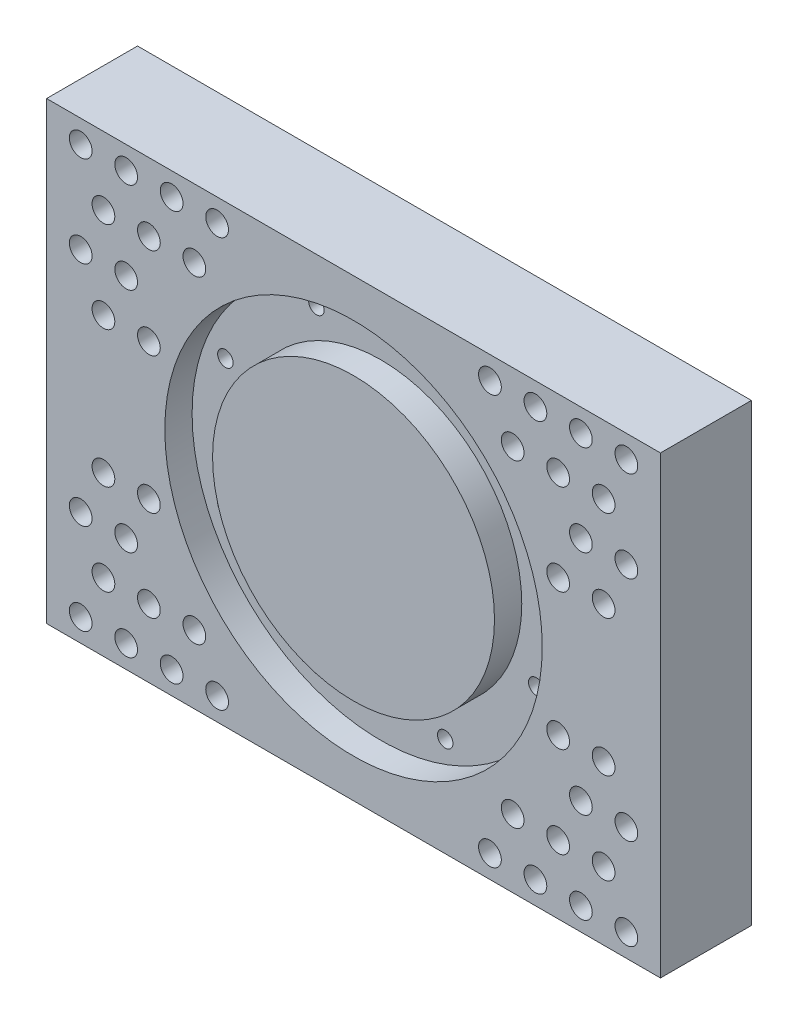
from build123d import *

# Parameters (mm, degrees)
SKETCH_1_W          = 135
SKETCH_1_H          = 100
EXTRUDE_1_DEPTH     = 20
SKETCH_2_R          = 1.7
CUT_EXTRUDE_1_DEPTH = 20
SKETCH_3_R          = 41.5
SKETCH_3_R_2        = 31
CUT_EXTRUDE_2_DEPTH = 6
SKETCH_4_R          = 2.5
CUT_EXTRUDE_3_DEPTH = 20


with BuildPart() as part:
    # 草图1 → 凸台-拉伸1 (new body)
    with BuildSketch(Plane.XY):
        Rectangle(SKETCH_1_W, SKETCH_1_H)
    extrude(amount=EXTRUDE_1_DEPTH)

    # 草图2 → 切除-拉伸1 (cut)
    with BuildSketch(Plane.XY.offset(20)):
        with Locations((14.159286998, 34.183542703)):
            Circle(SKETCH_2_R)
        with Locations((34.183542703, 14.159286998)):
            Circle(SKETCH_2_R)
        with Locations((34.183542703, -14.159286998)):
            Circle(SKETCH_2_R)
        with Locations((14.159286998, -34.183542703)):
            Circle(SKETCH_2_R)
        with Locations((-14.159286998, -34.183542703)):
            Circle(SKETCH_2_R)
        with Locations((-34.183542703, -14.159286998)):
            Circle(SKETCH_2_R)
        with Locations((-34.183542703, 14.159286998)):
            Circle(SKETCH_2_R)
        with Locations((-14.159286998, 34.183542703)):
            Circle(SKETCH_2_R)
    extrude(amount=-CUT_EXTRUDE_1_DEPTH, mode=Mode.SUBTRACT)

    # 草图3 → 切除-拉伸2 (cut)
    with BuildSketch(Plane.XY.offset(20)):
        Circle(SKETCH_3_R)
        Circle(SKETCH_3_R_2, mode=Mode.SUBTRACT)
    extrude(amount=-CUT_EXTRUDE_2_DEPTH, mode=Mode.SUBTRACT)

    # 草图4 → 切除-拉伸3 (cut)
    with BuildSketch(Plane.XY.offset(20)):
        with Locations((-60, 45)):
            Circle(SKETCH_4_R)
        with Locations((-50, 45)):
            Circle(SKETCH_4_R)
        with Locations((-55, 35)):
            Circle(SKETCH_4_R)
        with Locations((-40, 45)):
            Circle(SKETCH_4_R)
        with Locations((-45, 35)):
            Circle(SKETCH_4_R)
        with Locations((-30, 45)):
            Circle(SKETCH_4_R)
        with Locations((-35, 35)):
            Circle(SKETCH_4_R)
        with Locations((-50, 25)):
            Circle(SKETCH_4_R)
        with Locations((-55, 15)):
            Circle(SKETCH_4_R)
        with Locations((-60, 25)):
            Circle(SKETCH_4_R)
        with Locations((-45, 15)):
            Circle(SKETCH_4_R)
        with Locations(Location((45, 15, 0), (0, 0, 180))):
            Circle(SKETCH_4_R)
        with Locations(Location((60, 25, 0), (0, 0, 180))):
            Circle(SKETCH_4_R)
        with Locations(Location((55, 15, 0), (0, 0, 180))):
            Circle(SKETCH_4_R)
        with Locations(Location((50, 25, 0), (0, 0, 180))):
            Circle(SKETCH_4_R)
        with Locations(Location((35, 35, 0), (0, 0, 180))):
            Circle(SKETCH_4_R)
        with Locations(Location((30, 45, 0), (0, 0, 180))):
            Circle(SKETCH_4_R)
        with Locations(Location((45, 35, 0), (0, 0, 180))):
            Circle(SKETCH_4_R)
        with Locations(Location((40, 45, 0), (0, 0, 180))):
            Circle(SKETCH_4_R)
        with Locations(Location((55, 35, 0), (0, 0, 180))):
            Circle(SKETCH_4_R)
        with Locations(Location((50, 45, 0), (0, 0, 180))):
            Circle(SKETCH_4_R)
        with Locations(Location((60, 45, 0), (0, 0, 180))):
            Circle(SKETCH_4_R)
        with Locations((60, -45)):
            Circle(SKETCH_4_R)
        with Locations((50, -45)):
            Circle(SKETCH_4_R)
        with Locations((55, -35)):
            Circle(SKETCH_4_R)
        with Locations((40, -45)):
            Circle(SKETCH_4_R)
        with Locations((45, -35)):
            Circle(SKETCH_4_R)
        with Locations((30, -45)):
            Circle(SKETCH_4_R)
        with Locations((35, -35)):
            Circle(SKETCH_4_R)
        with Locations((50, -25)):
            Circle(SKETCH_4_R)
        with Locations((55, -15)):
            Circle(SKETCH_4_R)
        with Locations((60, -25)):
            Circle(SKETCH_4_R)
        with Locations((45, -15)):
            Circle(SKETCH_4_R)
        with Locations(Location((-45, -15, 0), (0, 0, 180))):
            Circle(SKETCH_4_R)
        with Locations(Location((-60, -25, 0), (0, 0, 180))):
            Circle(SKETCH_4_R)
        with Locations(Location((-55, -15, 0), (0, 0, 180))):
            Circle(SKETCH_4_R)
        with Locations(Location((-50, -25, 0), (0, 0, 180))):
            Circle(SKETCH_4_R)
        with Locations(Location((-35, -35, 0), (0, 0, 180))):
            Circle(SKETCH_4_R)
        with Locations(Location((-30, -45, 0), (0, 0, 180))):
            Circle(SKETCH_4_R)
        with Locations(Location((-45, -35, 0), (0, 0, 180))):
            Circle(SKETCH_4_R)
        with Locations(Location((-40, -45, 0), (0, 0, 180))):
            Circle(SKETCH_4_R)
        with Locations(Location((-55, -35, 0), (0, 0, 180))):
            Circle(SKETCH_4_R)
        with Locations(Location((-50, -45, 0), (0, 0, 180))):
            Circle(SKETCH_4_R)
        with Locations(Location((-60, -45, 0), (0, 0, 180))):
            Circle(SKETCH_4_R)
    extrude(amount=-CUT_EXTRUDE_3_DEPTH, mode=Mode.SUBTRACT)


solid = part.part
